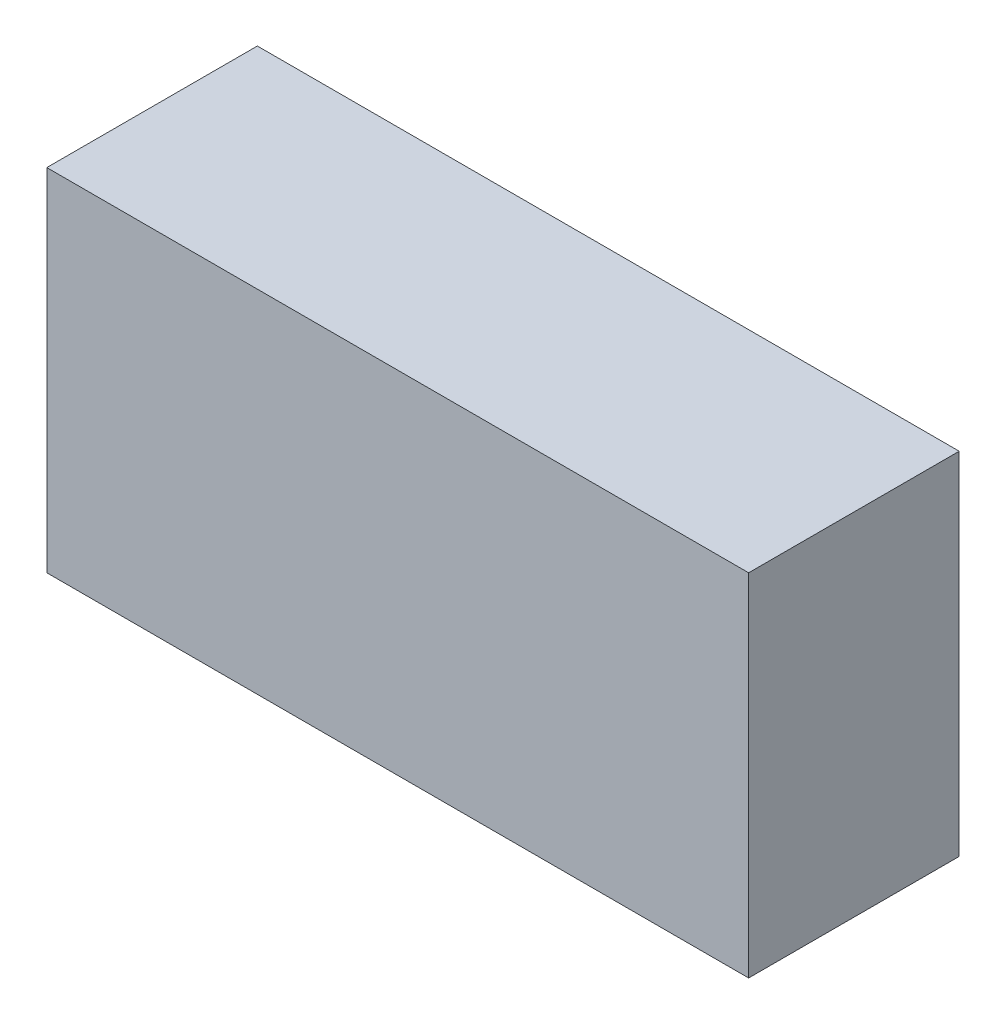
from build123d import *

# Parameters (mm, degrees)
SKETCH_1_W      = 20
SKETCH_1_H      = 10
EXTRUDE_1_DEPTH = 6


with BuildPart() as part:
    # Эскиз1 → Бобышка-Вытянуть1 (new body)
    with BuildSketch(Plane.XY):
        Rectangle(SKETCH_1_W, SKETCH_1_H)
    extrude(amount=EXTRUDE_1_DEPTH)


solid = part.part
